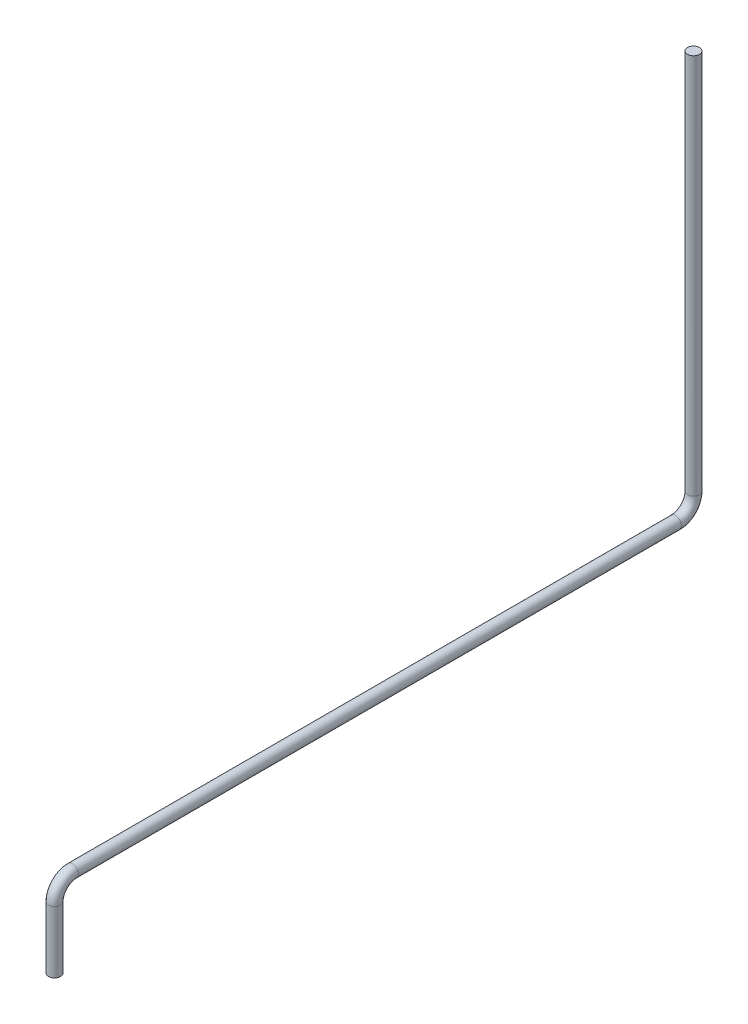
from build123d import *

# Parameters (mm, degrees)
CROQUIS1_R              = 15
SALIENTE_EXTRUIR1_DEPTH = 100
CROQUIS2_R              = 15


with BuildPart() as part:
    # Croquis1 → Saliente-Extruir1 (new body)
    with BuildSketch(Plane(origin=(0, 0, 0), x_dir=(1, 0, 0), z_dir=(0, 1, 0))):
        with Locations(Location((0, 0, 0), (0, 0, 270))):
            Circle(CROQUIS1_R)
    extrude(amount=-SALIENTE_EXTRUIR1_DEPTH)

    # Barrer1: sweep along a curve in space
    with BuildLine() as barrer1_path:
        Line((0, -100, 0), (0, -955, 0))
        ThreePointArc((0, -955, 0), (0, -986.819805153, 13.180194847), (0, -1000, 45))
        Line((0, -1000, 45), (0, -1000, 1555))
        ThreePointArc((0, -1000, 1555), (0, -1013.180194847, 1586.819805153), (0, -1045, 1600))
        Line((0, -1045, 1600), (0, -1200, 1600))
    # Croquis2 → Barrer1 (sweep)
    with BuildSketch(Plane.XZ.offset(100)):
        Circle(CROQUIS2_R)
    sweep(path=barrer1_path.line)


solid = part.part
